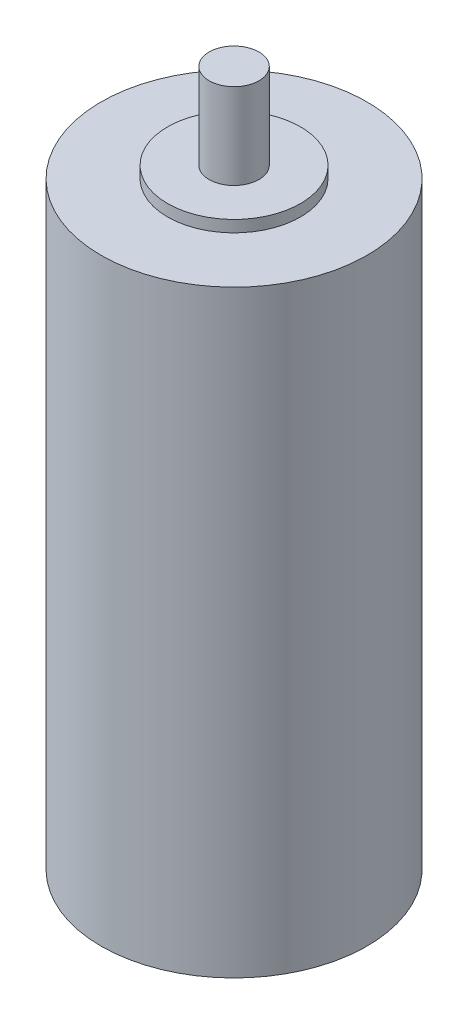
from build123d import *

# Parameters (mm, degrees)
SKETCH1_R           = 16
BOSS_EXTRUDE1_DEPTH = 72
SKETCH2_R           = 8
BOSS_EXTRUDE2_DEPTH = 1.4
SKETCH4_R           = 3
BOSS_EXTRUDE3_DEPTH = 11.7


with BuildPart() as part:
    # Sketch1 → Boss-Extrude1 (new body)
    with BuildSketch(Plane(origin=(0, 0, 0), x_dir=(1, 0, 0), z_dir=(0, 1, 0))):
        with Locations(Location((0, 0, 0), (0, 0, 270))):
            Circle(SKETCH1_R)
    extrude(amount=BOSS_EXTRUDE1_DEPTH)

    # Sketch2 → Boss-Extrude2 (add)
    with BuildSketch(Plane(origin=(0, 72, 0), x_dir=(1, 0, 0), z_dir=(0, 1, 0))):
        with Locations(Location((0, 0, 0), (0, 0, 270))):
            Circle(SKETCH2_R)
    extrude(amount=BOSS_EXTRUDE2_DEPTH)

    # Sketch4 → Boss-Extrude3 (add)
    with BuildSketch(Plane(origin=(0, 72, 0), x_dir=(1, 0, 0), z_dir=(0, 1, 0))):
        with Locations(Location((0, 0, 0), (0, 0, 270))):
            Circle(SKETCH4_R)
    extrude(amount=BOSS_EXTRUDE3_DEPTH)


solid = part.part
